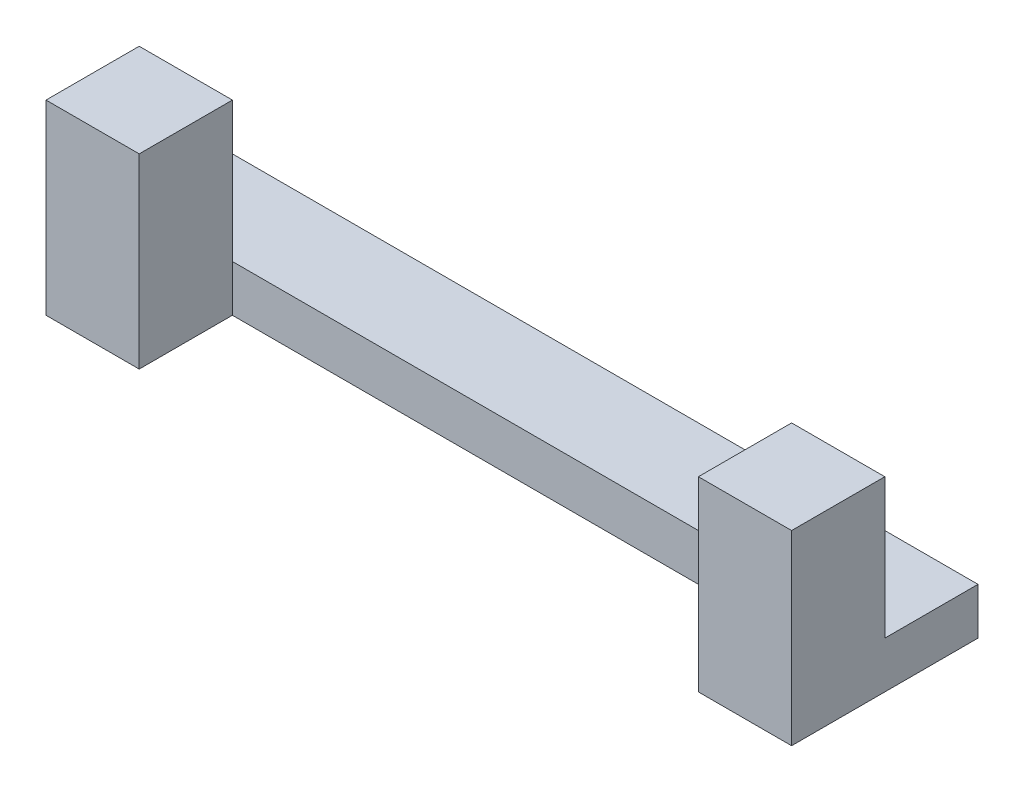
from build123d import *

# Parameters (mm, degrees)
SKETCH1_W           = 200
SKETCH1_H           = 25
BOSS_EXTRUDE3_DEPTH = 12.5
SKETCH2_W           = 25
SKETCH2_H           = 25
BOSS_EXTRUDE4_DEPTH = 50


with BuildPart() as part:
    # Sketch1 → Boss-Extrude3 (new body)
    with BuildSketch(Plane(origin=(0, 0, 0), x_dir=(1, 0, 0), z_dir=(0, 1, 0))):
        Rectangle(SKETCH1_W, SKETCH1_H)
    extrude(amount=BOSS_EXTRUDE3_DEPTH)

    # Sketch2 → Boss-Extrude4 (add)
    with BuildSketch(Plane(origin=(0, 0, 0), x_dir=(1, 0, 0), z_dir=(0, 1, 0))):
        with Locations((-87.5, -25)):
            Rectangle(SKETCH2_W, SKETCH2_H)
        with Locations((87.5, -25)):
            Rectangle(SKETCH2_W, SKETCH2_H)
    extrude(amount=BOSS_EXTRUDE4_DEPTH)


solid = part.part
